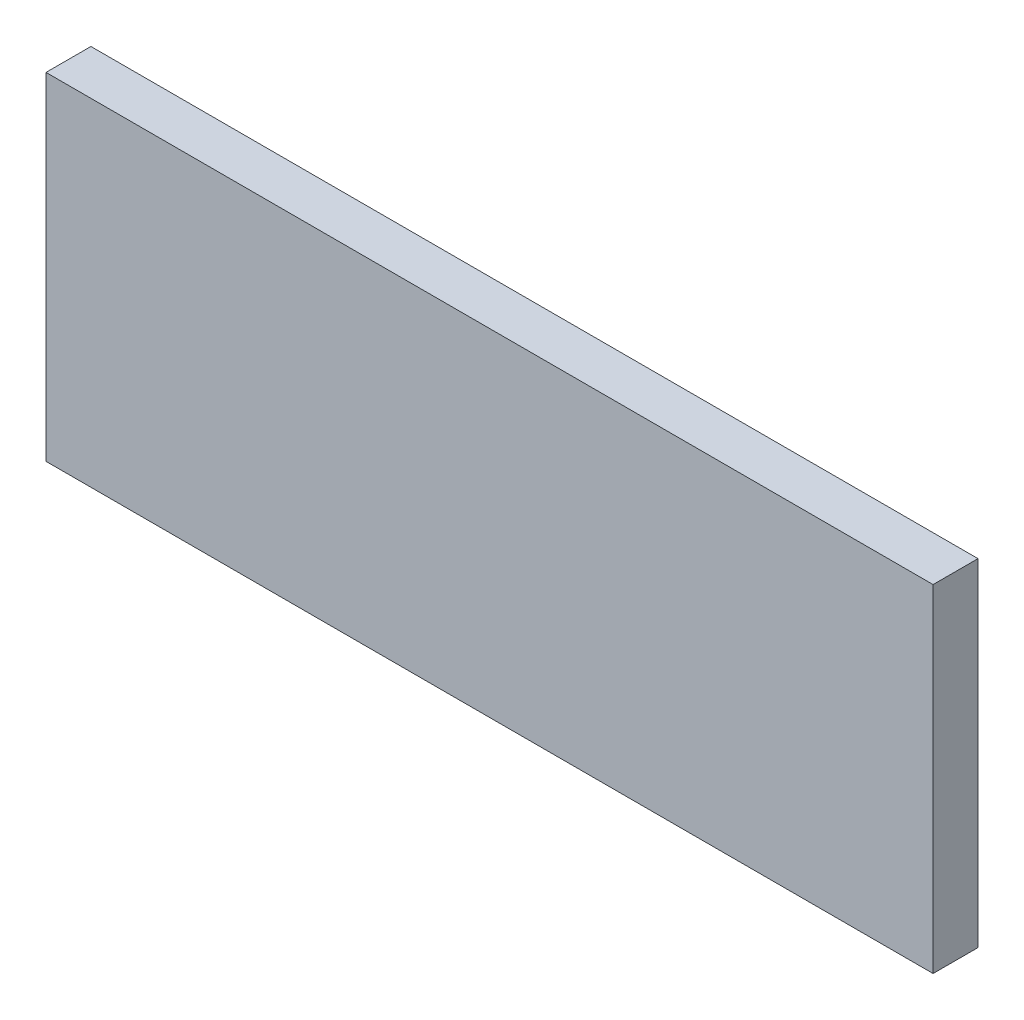
from build123d import *

# Parameters (mm, degrees)
SKETCH1_W           = 79
SKETCH1_H           = 30
BOSS_EXTRUDE1_DEPTH = 4


with BuildPart() as part:
    # Sketch1 → Boss-Extrude1 (new body)
    with BuildSketch(Plane.XY):
        Rectangle(SKETCH1_W, SKETCH1_H)
    extrude(amount=BOSS_EXTRUDE1_DEPTH)


solid = part.part
